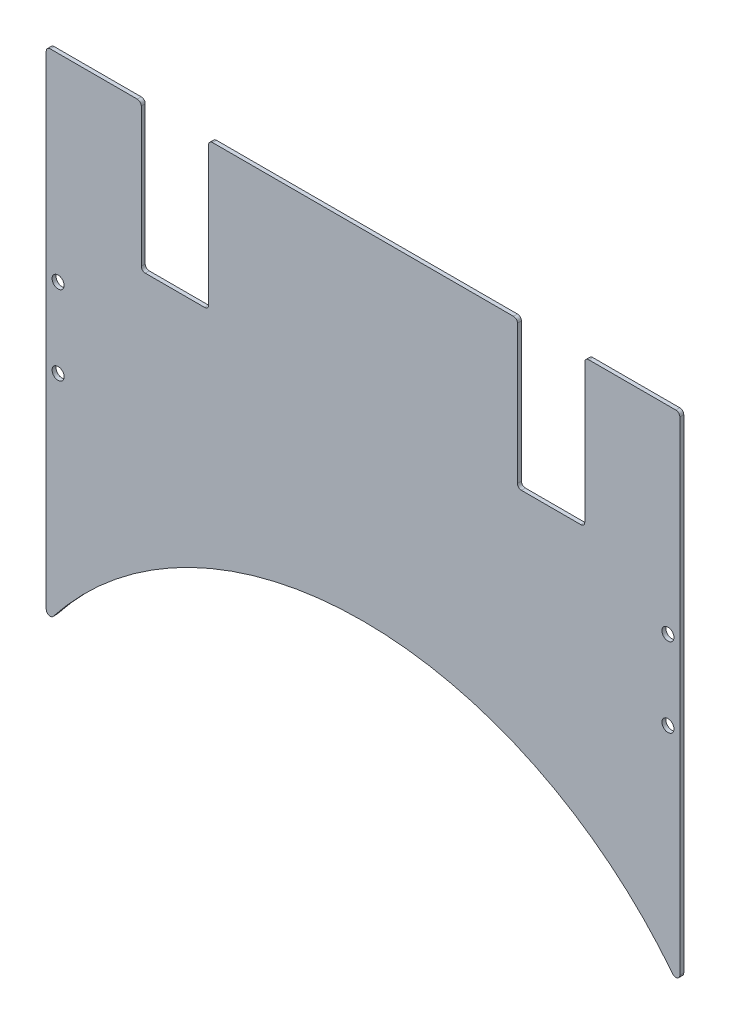
from build123d import *

# Parameters (mm, degrees)
SKETCH_1_W           = 160
SKETCH_1_H           = 104
EXTRUDE_1_DEPTH      = 0.5
SKETCH_12_R          = 99.362749495
CUT_EXTRUDE_6_DEPTH  = 1
EXTRUDE_3_DEPTH      = 1
SKETCH_17_W          = 17
SKETCH_17_H          = 92.283863988
CUT_EXTRUDE_9_DEPTH  = 1
SKETCH_21_R          = 1.525
CUT_EXTRUDE_14_DEPTH = 10
FILLET_4_R           = 1


with BuildPart() as part:
    # 草图1 → 凸台-拉伸1 (new, symmetric)
    with BuildSketch(Plane.XY):
        Rectangle(SKETCH_1_W, SKETCH_1_H)
    extrude(amount=EXTRUDE_1_DEPTH, both=True)

    # 草图12 → 切除-拉伸6 (cut)
    with BuildSketch(Plane(origin=(0, 0, -0.5), x_dir=(-1, 0, 0), z_dir=(0, 0, -1))):
        with Locations((0, -133)):
            Circle(SKETCH_12_R)
    extrude(amount=-CUT_EXTRUDE_6_DEPTH, mode=Mode.SUBTRACT)

    # 草图13 → 凸台-拉伸3 (add)
    with BuildSketch(Plane(origin=(0, 0, -0.5), x_dir=(-1, 0, 0), z_dir=(0, 0, -1))):
        with BuildLine():
            Line((80, -52), (80, -74.068209027))
            ThreePointArc((80, -74.068209027), (69.654320002, -62.139350184), (57.549595892, -52))
            Line((57.549595892, -52), (80, -52))
        make_face()
    extrude_3 = extrude(amount=-EXTRUDE_3_DEPTH)

    # 镜向2: 凸台-拉伸3 across plane
    add(extrude_3.mirror(Plane(origin=(0, 0, 0), x_dir=(0, 0, 1), z_dir=(1, 0, 0))))

    # 草图17 → 切除-拉伸9 (cut)
    with BuildSketch(Plane(origin=(0, 0, -0.5), x_dir=(-1, 0, 0), z_dir=(0, 0, -1))):
        with Locations((-47.5, 61.084572681)):
            Rectangle(SKETCH_17_W, SKETCH_17_H)
    cut_extrude_9 = extrude(amount=-CUT_EXTRUDE_9_DEPTH, mode=Mode.SUBTRACT)

    # 镜向4: 切除-拉伸9 across plane
    add(cut_extrude_9.mirror(Plane(origin=(0, 0, 0), x_dir=(0, 0, 1), z_dir=(1, 0, 0))), mode=Mode.SUBTRACT)

    # 草图21 → 切除-拉伸14 (cut)
    with BuildSketch(Plane(origin=(0, 0, -0.5), x_dir=(-1, 0, 0), z_dir=(0, 0, -1))):
        with Locations((-77, 2)):
            Circle(SKETCH_21_R)
        with Locations((-77, -18)):
            Circle(SKETCH_21_R)
        with Locations((77, -18)):
            Circle(SKETCH_21_R)
        with Locations((77, 2)):
            Circle(SKETCH_21_R)
    extrude(amount=-CUT_EXTRUDE_14_DEPTH, mode=Mode.SUBTRACT)

    # 圆角4
    fillet_4_edges = [part.edges().sort_by_distance(p)[0] for p in [
        (-80, -74.068209027, 0),
        (80, -74.068209027, 0),
        (39, 52, 0),
        (56, 52, 0),
        (56, 14.942640687, 0),
        (39, 14.942640687, 0),
        (-39, 14.942640687, 0),
        (-56, 14.942640687, 0),
        (-56, 52, 0),
        (-39, 52, 0),
        (-80, 52, 0),
        (80, 52, 0),
    ]]
    fillet(fillet_4_edges, radius=FILLET_4_R)


solid = part.part
